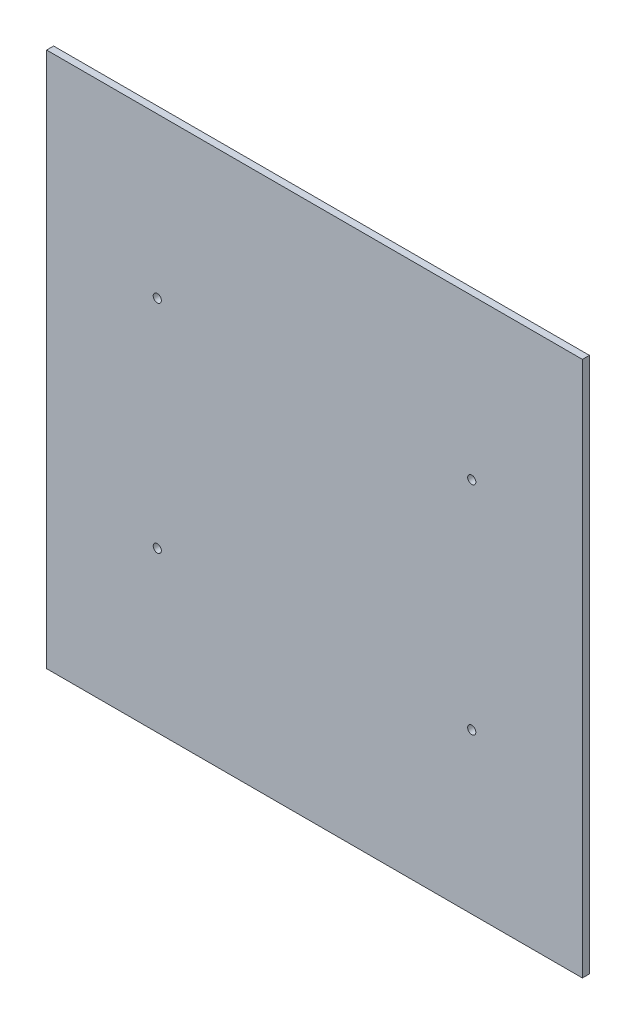
from build123d import *

# Parameters (mm, degrees)
SKETCH1_W           = 230
SKETCH1_H           = 230
BOSS_EXTRUDE1_DEPTH = 3
SKETCH2_R           = 1.75
CUT_EXTRUDE1_DEPTH  = 10


with BuildPart() as part:
    # Sketch1 → Boss-Extrude1 (new body)
    with BuildSketch(Plane.XY):
        with Locations((-83.312913379, -71.652065502)):
            Rectangle(SKETCH1_W, SKETCH1_H)
    extrude(amount=BOSS_EXTRUDE1_DEPTH)

    # Sketch2 → Cut-Extrude1 (cut)
    with BuildSketch(Plane.XY.offset(3)):
        with Locations((-15.812913379, -25.152065502)):
            Circle(SKETCH2_R)
        with Locations((-15.812913379, -118.152065502)):
            Circle(SKETCH2_R)
        with Locations((-150.812913379, -118.152065502)):
            Circle(SKETCH2_R)
        with Locations((-150.812913379, -25.152065502)):
            Circle(SKETCH2_R)
    extrude(amount=-CUT_EXTRUDE1_DEPTH, mode=Mode.SUBTRACT)


solid = part.part
